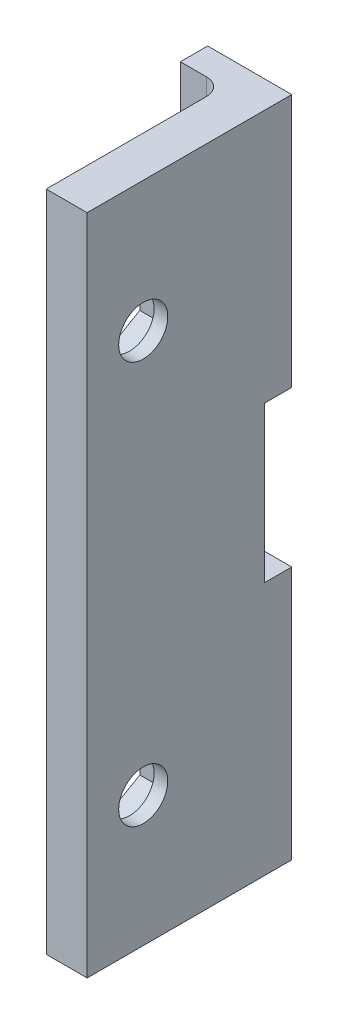
from build123d import *

# Parameters (mm, degrees)
SKETCH2_W             = 6.16625
SKETCH2_H             = 18.6
BOSS_EXTRUDE1_DEPTH   = 2
BOSS_EXTRUDE1_2_DEPTH = 2
SKETCH3_W             = 3
SKETCH3_H             = 48.6
BOSS_EXTRUDE2_DEPTH   = 13
FILLET1_R             = 1.25
CUT_EXTRUDE1_DEPTH    = 2
M3_CLEARANCE_HOLE1_D  = 3.6


with BuildPart() as part:
    # Sketch2 → Boss-Extrude1 (new body)
    with BuildSketch(Plane.XY.offset(11.211435671)):
        with Locations((-7.173848327, -28.012787822)):
            Rectangle(SKETCH2_W, SKETCH2_H)
    extrude(amount=BOSS_EXTRUDE1_DEPTH)



with BuildPart() as body_2:
    # Sketch2 → Boss-Extrude1 2 (new body)
    with BuildSketch(Plane.XY.offset(11.211435671)):
        with Locations((-7.173848327, -58.012787822)):
            Rectangle(SKETCH2_W, SKETCH2_H)
    extrude(amount=BOSS_EXTRUDE1_2_DEPTH)


with BuildPart() as part_1:
    add(part.part)

    add(body_2.part)  # Boss-Extrude2 merges body 2
    # Sketch3 → Boss-Extrude2 (add)
    with BuildSketch(Plane.XY.offset(13.211435671)):
        with Locations((-5.590723327, -43.012787822)):
            Rectangle(SKETCH3_W, SKETCH3_H)
    extrude(amount=BOSS_EXTRUDE2_DEPTH)

    # Fillet1
    fillet1_edges = [part_1.edges().sort_by_distance(p)[0] for p in [
        (-7.090723327, -58.012787822, 13.211435671),
        (-7.090723327, -28.012787822, 13.211435671),
    ]]
    fillet(fillet1_edges, radius=FILLET1_R)

    # Sketch4 → Cut-Extrude1 (cut)
    with BuildSketch(Plane(origin=(-7.090723327, 0, 0), x_dir=(0, 0, -1), z_dir=(1, 0, 0))):
        Polygon((-19.351262419, -29.850501062), (-22.101262419, -31.438214302), (-24.851262419, -29.850501062), (-24.851262419, -26.675074581), (-22.101262419, -25.087361341), (-19.351262419, -26.675074581), align=None)
        Polygon((-22.101262419, -60.938214302), (-19.351262419, -59.350501062), (-19.351262419, -56.175074581), (-22.101262419, -54.587361341), (-24.851262419, -56.175074581), (-24.851262419, -59.350501062), align=None)
    extrude(amount=CUT_EXTRUDE1_DEPTH, mode=Mode.SUBTRACT)

    # M3 Clearance Hole1 (through all)
    with Locations(Plane.ZY.offset(7.090723327)):
        with Locations((22.101262419, -57.762787822), (22.101262419, -28.262787822)):
            Hole(M3_CLEARANCE_HOLE1_D / 2)


solid = part_1.part
